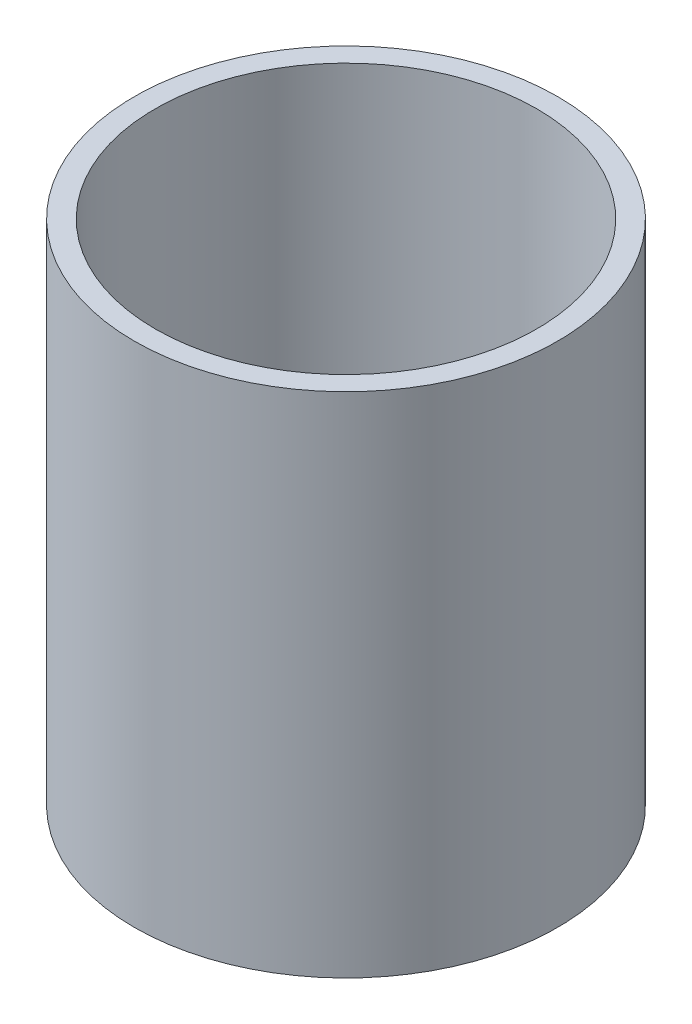
from build123d import *

# Parameters (mm, degrees)
SKETCH2_R           = 63.557348815
BOSS_EXTRUDE1_DEPTH = 152.4
SKETCH4_R           = 57.254483752
CUT_EXTRUDE1_DEPTH  = 152.4


with BuildPart() as part:
    # Sketch2 → Boss-Extrude1 (new body)
    with BuildSketch(Plane(origin=(0, 0, 0), x_dir=(1, 0, 0), z_dir=(0, 1, 0))):
        with Locations(Location((0, 0, 0), (0, 0, 90))):
            Circle(SKETCH2_R)
    extrude(amount=BOSS_EXTRUDE1_DEPTH)

    # Sketch4 → Cut-Extrude1 (cut)
    with BuildSketch(Plane(origin=(0, 0, 0), x_dir=(-1, 0, 0), z_dir=(0, -1, 0))):
        with Locations(Location((0, 0, 0), (0, 0, 90))):
            Circle(SKETCH4_R)
    extrude(amount=-CUT_EXTRUDE1_DEPTH, mode=Mode.SUBTRACT)


solid = part.part
